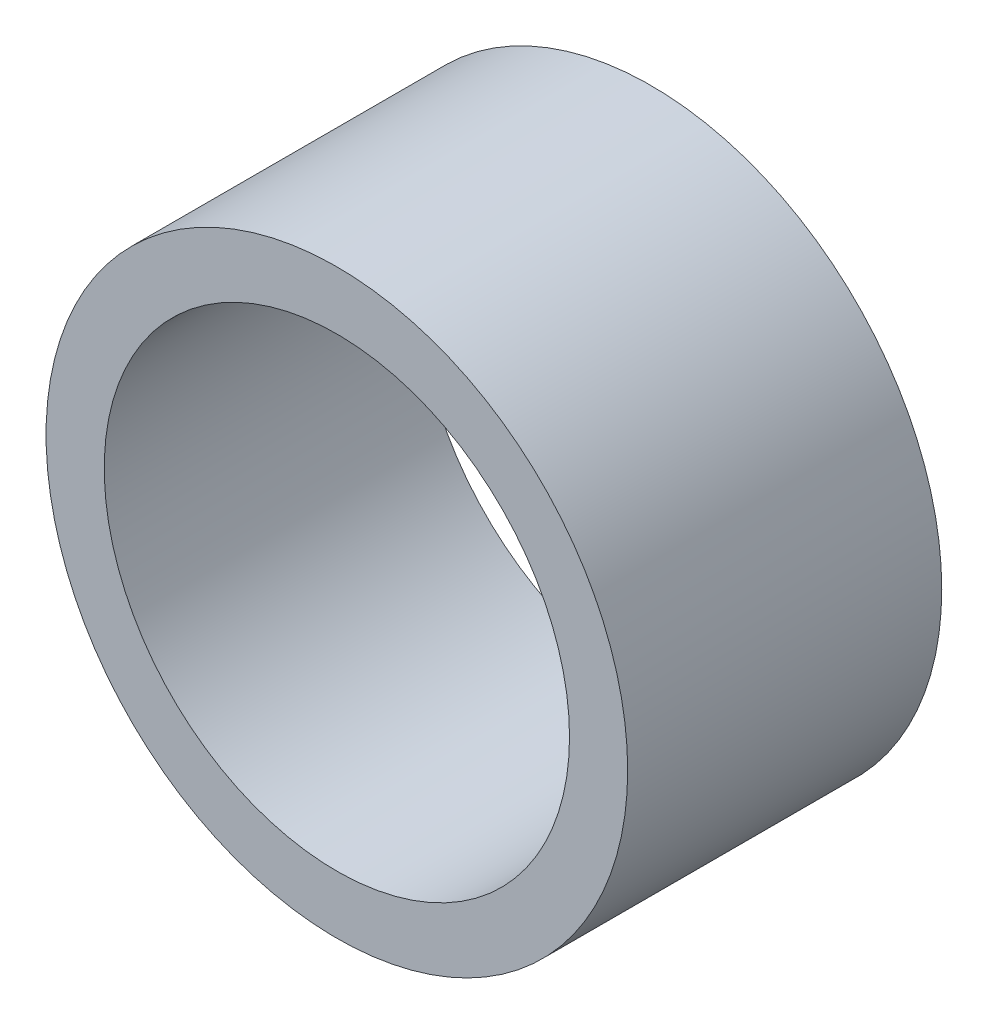
from build123d import *

# Parameters (mm, degrees)
SKIZZE1_R                       = 2
SCHNITT_LINEAR_AUSTRAGEN1_DEPTH = 5.062019202


with BuildPart() as part:
    # Sketch1 → Revolve1 (revolve)
    with BuildSketch(Plane(origin=(0, 0, 0), x_dir=(0, 0, -1), z_dir=(1, 0, 0)), mode=Mode.PRIVATE) as revolve1_sk:
        Polygon((0, 2.5), (2.7, 2.5), (2.7, 1.5), (4, 1.5), (4, 0.5), (2, 0.5), (2, 2), (0, 2), align=None)
    revolve(revolve1_sk.sketch.rotate(Axis((0, 0, 20.700415561), (0, 0, -1)), 90), axis=Axis((0, 0, 20.700415561), (0, 0, -1)))

    # Skizze1 → Schnitt-Linear austragen1 (cut, through all)
    with BuildSketch(Plane.XY.offset(-2)):
        Circle(SKIZZE1_R)
    extrude(amount=-SCHNITT_LINEAR_AUSTRAGEN1_DEPTH, mode=Mode.SUBTRACT)


solid = part.part
